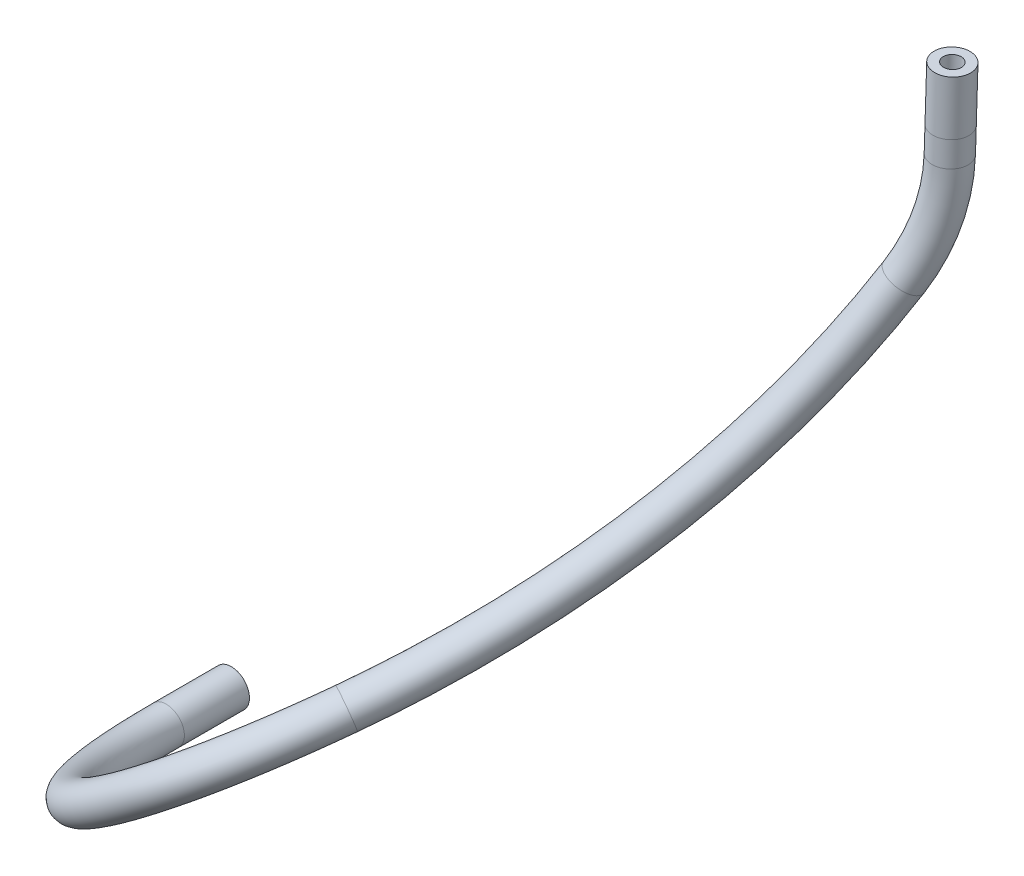
from build123d import *

# Parameters (mm, degrees)
SWEEP1_PROFILE_R     = 6.35
CUT_SWEEP1_PROFILE_R = 3.175


with BuildPart() as part:
    # Sweep1: sweep along a curve in space
    with BuildLine() as sweep1_path:
        Line((44.09223227, 18.666797388, 9.772665845), (44.09223227, 18.666797388, -12.977334155))
        ThreePointArc((44.09223227, 18.666797388, 9.772665845), (83.44709616, 47.763643929, 75.881872817), (145.777808921, 93.847583872, 48.36802607))
        ThreePointArc((145.777808921, 93.847583872, 48.36802607), (186.971547467, 138.178197356, -19.900895831), (224.914532295, 206.184188109, -67.422345819))
        ThreePointArc((233.124989376, 243.66897146, -75.320122751), (230.785950694, 224.145501617, -73.242307626), (224.914532295, 206.184188109, -67.422345819))
        Line((233.347766263, 252.639211932, -75.379620636), (233.124989376, 243.66897146, -75.320122751))
        Line((233.823290134, 271.786456188, -75.506620636), (233.347766263, 252.639211932, -75.379620636))
    # Sweep1 profile (on start of the path) → Sweep1 (sweep)
    with BuildSketch(Plane(origin=(233.823290134, 271.786456188, -75.506620636), x_dir=(-0.999691751300367, 0.024827452185136066, 0), z_dir=(-0.02482690640849771, -0.9996697752877118, 0.006630617950041174))):
        Circle(SWEEP1_PROFILE_R)
    sweep(path=sweep1_path.line)

    # Cut-Sweep1: sweep along a curve in space
    with BuildLine() as cut_sweep1_path:
        Line((44.09223227, 18.666797388, 9.772665845), (44.09223227, 18.666797388, -12.977334155))
        ThreePointArc((44.09223227, 18.666797388, 9.772665845), (83.44709616, 47.763643929, 75.881872817), (145.777808921, 93.847583872, 48.36802607))
        ThreePointArc((145.777808921, 93.847583872, 48.36802607), (186.971547467, 138.178197356, -19.900895831), (224.914532295, 206.184188109, -67.422345819))
        ThreePointArc((233.124989376, 243.66897146, -75.320122751), (230.785950694, 224.145501617, -73.242307626), (224.914532295, 206.184188109, -67.422345819))
        Line((233.347766263, 252.639211932, -75.379620636), (233.124989376, 243.66897146, -75.320122751))
        Line((233.823290134, 271.786456188, -75.506620636), (233.347766263, 252.639211932, -75.379620636))
    # Cut-Sweep1 profile (on start of the path) → Cut-Sweep1 (sweep, cut)
    with BuildSketch(Plane(origin=(233.823290134, 271.786456188, -75.506620636), x_dir=(-0.999691751300367, 0.024827452185136066, 0), z_dir=(-0.02482690640849771, -0.9996697752877118, 0.006630617950041174))):
        Circle(CUT_SWEEP1_PROFILE_R)
    sweep(path=cut_sweep1_path.line, mode=Mode.SUBTRACT)


solid = part.part
